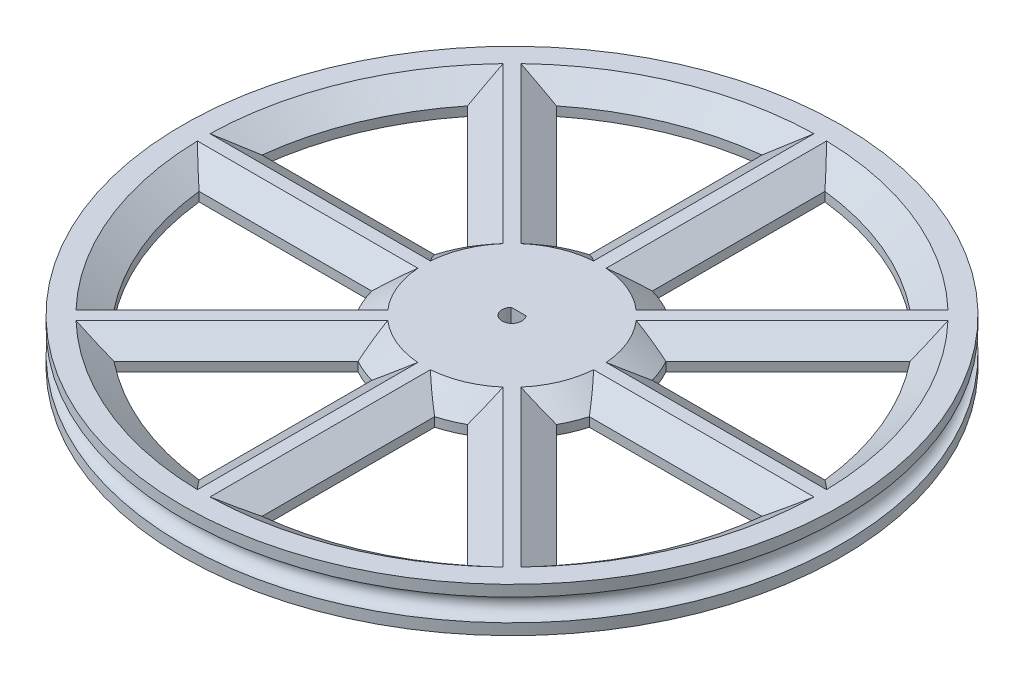
from build123d import *

# Parameters (mm, degrees)
SKETCH1_R           = 52.3621
BOSS_EXTRUDE1_DEPTH = 7.06
SKETCH4_R           = 1.7653
SKETCH6_R           = 1.575
CUT_EXTRUDE1_DEPTH  = 7.06
BOSS_EXTRUDE2_DEPTH = 7.06
CUT_EXTRUDE3_DEPTH  = 7.06
CHAMFER17_SIZE      = 4
CHAMFER17_SIZE2     = 2.800830153
CHAMFER18_SIZE      = 4
CHAMFER18_SIZE2     = 2.800830153
CHAMFER19_SIZE      = 4
CHAMFER19_SIZE2     = 2.800830153
CHAMFER20_SIZE      = 4
CHAMFER20_SIZE2     = 2.800830153
CHAMFER21_SIZE      = 4
CHAMFER21_SIZE2     = 2.800830153
CHAMFER25_SIZE      = 4
CHAMFER25_SIZE2     = 2.800830153
CHAMFER26_SIZE      = 4
CHAMFER26_SIZE2     = 2.800830153
CHAMFER39_SIZE      = 4
CHAMFER39_SIZE2     = 2.800830153
CHAMFER40_SIZE      = 4
CHAMFER40_SIZE2     = 2.800830153
CHAMFER42_SIZE      = 4
CHAMFER42_SIZE2     = 2.800830153
CHAMFER43_SIZE      = 4
CHAMFER43_SIZE2     = 2.800830153
CHAMFER44_SIZE      = 4
CHAMFER44_SIZE2     = 2.800830153
CHAMFER45_SIZE      = 4
CHAMFER45_SIZE2     = 2.800830153
CHAMFER46_SIZE      = 4
CHAMFER46_SIZE2     = 2.800830153


with BuildPart() as part:
    # Sketch1 → Boss-Extrude1 (new body)
    with BuildSketch(Plane(origin=(0, 0, 0), x_dir=(1, 0, 0), z_dir=(0, 1, 0))):
        with Locations(Location((0, 0, 0), (0, 0, 270))):
            Circle(SKETCH1_R)
    extrude(amount=BOSS_EXTRUDE1_DEPTH)

    # Sketch4 → Cut-Revolve2 (revolve, cut)
    with BuildSketch(Plane(origin=(0, 0, 0), x_dir=(0, 0, -1), z_dir=(1, 0, 0)), mode=Mode.PRIVATE) as cut_revolve2_sk:
        with Locations((-52.3621, 3.53)):
            Circle(SKETCH4_R)
    revolve(cut_revolve2_sk.sketch.rotate(Axis((0, 3.53, 0), (0, 1, 0)), 180), axis=Axis((0, 3.53, 0), (0, 1, 0)), mode=Mode.SUBTRACT)

    # Sketch6 → Cut-Extrude1 (cut)
    with BuildSketch(Plane(origin=(0, 7.06, 0), x_dir=(1, 0, 0), z_dir=(0, 1, 0))):
        with Locations(Location((0, 0, 0), (0, 0, 270))):
            Circle(SKETCH6_R)
    extrude(amount=-CUT_EXTRUDE1_DEPTH, mode=Mode.SUBTRACT)

    # Sketch7 → Boss-Extrude2 (add)
    with BuildSketch(Plane(origin=(0, 7.06, 0), x_dir=(1, 0, 0), z_dir=(0, 1, 0))):
        with BuildLine():
            Line((-1.173935688, 1.05), (1.173935688, 1.05))
            ThreePointArc((1.173935688, 1.05), (0, 1.575), (-1.173935688, 1.05))
        make_face()
    extrude(amount=-BOSS_EXTRUDE2_DEPTH)

    # Sketch8 → Cut-Extrude3 (cut)
    with BuildSketch(Plane(origin=(0, 7.06, 0), x_dir=(1, 0, 0), z_dir=(0, 1, 0))):
        with BuildLine():
            Line((-44.72135955, 5), (-17.291616466, 5))
            ThreePointArc((-17.291616466, 5), (-16.629831585, 6.888301783), (-15.762553167, 8.691485355))
            Line((-15.762553167, 8.691485355), (-35.158310508, 28.087242696))
            ThreePointArc((-35.158310508, 28.087242696), (-41.574578963, 17.220754456), (-44.72135955, 5))
        make_face()
        with BuildLine():
            Line((-17.291616466, -5), (-44.72135955, -5))
            ThreePointArc((-44.72135955, -5), (-41.574578963, -17.220754456), (-35.158310508, -28.087242696))
            Line((-35.158310508, -28.087242696), (-15.762553167, -8.691485355))
            ThreePointArc((-15.762553167, -8.691485355), (-16.629831585, -6.888301783), (-17.291616466, -5))
        make_face()
        with BuildLine():
            Line((17.291616466, -5), (44.72135955, -5))
            ThreePointArc((44.72135955, -5), (41.574578963, -17.220754456), (35.158310508, -28.087242696))
            Line((35.158310508, -28.087242696), (15.762553167, -8.691485355))
            ThreePointArc((15.762553167, -8.691485355), (16.629831585, -6.888301783), (17.291616466, -5))
        make_face()
        with BuildLine():
            Line((15.762553167, 8.691485355), (35.158310508, 28.087242696))
            ThreePointArc((35.158310508, 28.087242696), (41.574578963, 17.220754456), (44.72135955, 5))
            Line((44.72135955, 5), (17.291616466, 5))
            ThreePointArc((17.291616466, 5), (16.629831585, 6.888301783), (15.762553167, 8.691485355))
        make_face()
        with BuildLine():
            Line((-28.087242696, 35.158310508), (-8.691485355, 15.762553167))
            ThreePointArc((-8.691485355, 15.762553167), (-6.888301783, 16.629831585), (-5, 17.291616466))
            Line((-5, 17.291616466), (-5, 44.72135955))
            ThreePointArc((-5, 44.72135955), (-17.220754456, 41.574578963), (-28.087242696, 35.158310508))
        make_face()
        with BuildLine():
            Line((5, 17.291616466), (5, 44.72135955))
            ThreePointArc((5, 44.72135955), (17.220754456, 41.574578963), (28.087242696, 35.158310508))
            Line((28.087242696, 35.158310508), (8.691485355, 15.762553167))
            ThreePointArc((8.691485355, 15.762553167), (6.888301783, 16.629831585), (5, 17.291616466))
        make_face()
        with BuildLine():
            Line((-28.087242696, -35.158310508), (-8.691485355, -15.762553167))
            ThreePointArc((-8.691485355, -15.762553167), (-6.888301783, -16.629831585), (-5, -17.291616466))
            Line((-5, -17.291616466), (-5, -44.72135955))
            ThreePointArc((-5, -44.72135955), (-17.220754456, -41.574578963), (-28.087242696, -35.158310508))
        make_face()
        with BuildLine():
            Line((5, -17.291616466), (5, -44.72135955))
            ThreePointArc((5, -44.72135955), (17.220754456, -41.574578963), (28.087242696, -35.158310508))
            Line((28.087242696, -35.158310508), (8.691485355, -15.762553167))
            ThreePointArc((8.691485355, -15.762553167), (6.888301783, -16.629831585), (5, -17.291616466))
        make_face()
    extrude(amount=-CUT_EXTRUDE3_DEPTH, mode=Mode.SUBTRACT)

    # Chamfer17
    chamfer17_edges = [part.edges().sort_by_distance(p)[0] for p in [
        (-18.389364025, 7.06, -25.460431837),
        (-25.460431837, 7.06, -18.389364025),
    ]]
    chamfer17_side = [part.faces().sort_by_distance(p)[0] for p in [
        (0, 7.06, -50.881076161),
    ]]
    chamfer(chamfer17_edges, length=CHAMFER17_SIZE, length2=CHAMFER17_SIZE2, reference=chamfer17_side[0])

    # Chamfer18
    chamfer18_edges = [part.edges().sort_by_distance(p)[0] for p in [
        (-18.389364025, 0, -25.460431837),
    ]]
    chamfer18_side = [part.faces().sort_by_distance(p)[0] for p in [
        (0, 0, -50.881076161),
    ]]
    chamfer(chamfer18_edges, length=CHAMFER18_SIZE, length2=CHAMFER18_SIZE2, reference=chamfer18_side[0])

    # Chamfer19
    chamfer19_edges = [part.edges().sort_by_distance(p)[0] for p in [
        (-25.460431837, 0, -18.389364025),
    ]]
    chamfer19_side = [part.faces().sort_by_distance(p)[0] for p in [
        (-19.682698274, 0, -42.107920464),
    ]]
    chamfer(chamfer19_edges, length=CHAMFER19_SIZE, length2=CHAMFER19_SIZE2, reference=chamfer19_side[0])

    # Chamfer20
    chamfer20_edges = [part.edges().sort_by_distance(p)[0] for p in [
        (-31.006488008, 7.06, -5),
        (-31.006488008, 7.06, 5),
    ]]
    chamfer20_side = [part.faces().sort_by_distance(p)[0] for p in [
        (-19.682698274, 7.06, -42.107920464),
    ]]
    chamfer(chamfer20_edges, length=CHAMFER20_SIZE, length2=CHAMFER20_SIZE2, reference=chamfer20_side[0])

    # Chamfer21
    chamfer21_edges = [part.edges().sort_by_distance(p)[0] for p in [
        (18.389364025, 7.06, -25.460431837),
        (5, 7.06, -31.006488008),
        (-5, 7.06, -31.006488008),
        (-25.460431837, 7.06, 18.389364025),
        (31.006488008, 7.06, -5),
        (25.460431837, 7.06, -18.389364025),
        (25.460431837, 7.06, 18.389364025),
        (31.006488008, 7.06, 5),
        (-18.389364025, 7.06, 25.460431837),
        (-5, 7.06, 31.006488008),
        (5, 7.06, 31.006488008),
        (18.389364025, 7.06, 25.460431837),
    ]]
    chamfer21_side = [part.faces().sort_by_distance(p)[0] for p in [
        (2.323352496, 7.06, 0.962148374),
    ]]
    chamfer(chamfer21_edges, length=CHAMFER21_SIZE, length2=CHAMFER21_SIZE2, reference=chamfer21_side[0])

    # Chamfer25
    chamfer25_edges = [part.edges().sort_by_distance(p)[0] for p in [
        (5, 0, -31.006488008),
        (-5, 0, -31.006488008),
    ]]
    chamfer25_side = [part.faces().sort_by_distance(p)[0] for p in [
        (-14.451812174, 0, -8.001356027),
    ]]
    chamfer(chamfer25_edges, length=CHAMFER25_SIZE, length2=CHAMFER25_SIZE2, reference=chamfer25_side[0])

    # Chamfer26
    chamfer26_edges = [part.edges().sort_by_distance(p)[0] for p in [
        (18.389364025, 0, -25.460431837),
        (25.460431837, 0, -18.389364025),
        (31.006488008, 0, -5),
        (31.006488008, 0, 5),
        (25.460431837, 0, 18.389364025),
        (18.389364025, 0, 25.460431837),
    ]]
    chamfer26_side = [part.faces().sort_by_distance(p)[0] for p in [
        (0.962364114, 0, 2.323136756),
    ]]
    chamfer(chamfer26_edges, length=CHAMFER26_SIZE, length2=CHAMFER26_SIZE2, reference=chamfer26_side[0])

    # Chamfer39
    chamfer39_edges = [part.edges().sort_by_distance(p)[0] for p in [
        (16.629831585, 0, 6.888301783),
    ]]
    chamfer39_side = [part.faces().sort_by_distance(p)[0] for p in [
        (-2.671933538, 0, 2.671685429),
    ]]
    chamfer(chamfer39_edges, length=CHAMFER39_SIZE, length2=CHAMFER39_SIZE2, reference=chamfer39_side[0])

    # Chamfer40
    chamfer40_edges = [part.edges().sort_by_distance(p)[0] for p in [
        (16.629831585, 0, -6.888301783),
        (6.888301783, 0, -16.629831585),
        (-6.888301783, 0, -16.629831585),
        (-31.006488008, 0, -5),
        (-31.006488008, 0, 5),
        (-25.460431837, 0, 18.389364025),
        (-18.389364025, 0, 25.460431837),
        (-5, 0, 31.006488008),
        (5, 0, 31.006488008),
    ]]
    chamfer40_side = [part.faces().sort_by_distance(p)[0] for p in [
        (-2.841532186, 0, 2.638527927),
    ]]
    chamfer(chamfer40_edges, length=CHAMFER40_SIZE, length2=CHAMFER40_SIZE2, reference=chamfer40_side[0])

    # Chamfer42
    chamfer42_edges = [part.edges().sort_by_distance(p)[0] for p in [
        (-16.629831585, 0, -6.888301783),
        (-16.629831585, 0, 6.888301783),
        (-6.888301783, 0, 16.629831585),
        (6.888301783, 0, 16.629831585),
    ]]
    chamfer42_side = [part.faces().sort_by_distance(p)[0] for p in [
        (20.502942916, 0, -21.183213354),
    ]]
    chamfer(chamfer42_edges, length=CHAMFER42_SIZE, length2=CHAMFER42_SIZE2, reference=chamfer42_side[0])

    # Chamfer43
    chamfer43_edges = [part.edges().sort_by_distance(p)[0] for p in [
        (-6.888301783, 7.06, -16.629831585),
        (6.888301783, 7.06, -16.629831585),
        (16.629831585, 7.06, -6.888301783),
        (16.629831585, 7.06, 6.888301783),
        (6.888301783, 7.06, 16.629831585),
        (-6.888301783, 7.06, 16.629831585),
        (-16.629831585, 7.06, 6.888301783),
        (-16.629831585, 7.06, -6.888301783),
    ]]
    chamfer43_side = [part.faces().sort_by_distance(p)[0] for p in [
        (22.600241453, 7.06, -21.919971015),
    ]]
    chamfer(chamfer43_edges, length=CHAMFER43_SIZE, length2=CHAMFER43_SIZE2, reference=chamfer43_side[0])

    # Chamfer44
    chamfer44_edges = [part.edges().sort_by_distance(p)[0] for p in [
        (41.574578963, 0, -17.220754456),
    ]]
    chamfer44_side = [part.faces().sort_by_distance(p)[0] for p in [
        (-29.47656378, 0, 0.481023839),
    ]]
    chamfer(chamfer44_edges, length=CHAMFER44_SIZE, length2=CHAMFER44_SIZE2, reference=chamfer44_side[0])

    # Chamfer45
    chamfer45_edges = [part.edges().sort_by_distance(p)[0] for p in [
        (17.220754456, 0, -41.574578963),
        (-17.220754456, 0, -41.574578963),
        (-41.574578963, 0, -17.220754456),
        (-41.574578963, 0, 17.220754456),
        (-17.220754456, 0, 41.574578963),
        (17.220754456, 0, 41.574578963),
        (41.574578963, 0, 17.220754456),
    ]]
    chamfer45_side = [part.faces().sort_by_distance(p)[0] for p in [
        (-1.843064588, 0, 0.763087098),
    ]]
    chamfer(chamfer45_edges, length=CHAMFER45_SIZE, length2=CHAMFER45_SIZE2, reference=chamfer45_side[0])

    # Chamfer46
    chamfer46_edges = [part.edges().sort_by_distance(p)[0] for p in [
        (-41.574578963, 7.06, 17.220754456),
        (-17.220754456, 7.06, 41.574578963),
        (17.220754456, 7.06, 41.574578963),
        (41.574578963, 7.06, 17.220754456),
        (41.574578963, 7.06, -17.220754456),
        (17.220754456, 7.06, -41.574578963),
        (-17.220754456, 7.06, -41.574578963),
        (-41.574578963, 7.06, -17.220754456),
    ]]
    chamfer46_side = [part.faces().sort_by_distance(p)[0] for p in [
        (0.481023839, 7.06, -29.47656378),
    ]]
    chamfer(chamfer46_edges, length=CHAMFER46_SIZE, length2=CHAMFER46_SIZE2, reference=chamfer46_side[0])


solid = part.part
